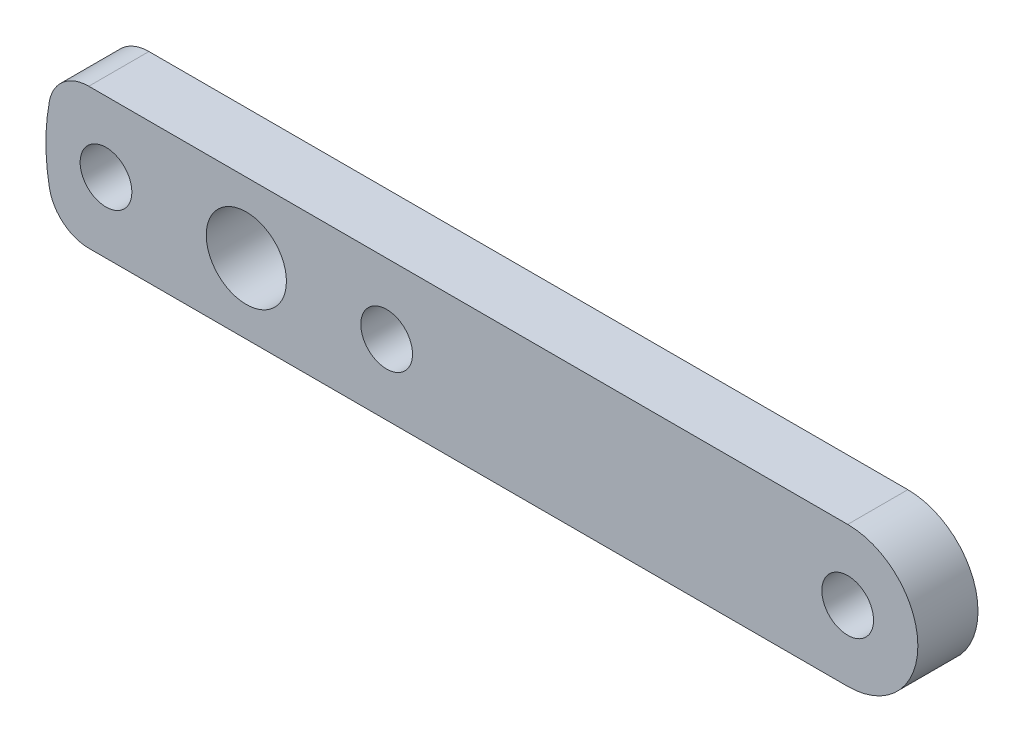
from build123d import *

# Parameters (mm, degrees)
SKETCH1_R           = 1.29
SKETCH1_R_2         = 2
BOSS_EXTRUDE1_DEPTH = 1.5
FILLET1_R           = 2


with BuildPart() as part:
    # Sketch1 → Boss-Extrude1 (new, symmetric)
    with BuildSketch(Plane.XY):
        with BuildLine():
            Line((-9.367496998, 3.5), (30, 3.5))
            ThreePointArc((30, 3.5), (33.5, 0), (30, -3.5))
            Line((30, -3.5), (-9.367496998, -3.5))
            ThreePointArc((-9.367496998, -3.5), (-10, 0), (-9.367496998, 3.5))
        make_face()
        with Locations((-7, 0)):
            Circle(SKETCH1_R, mode=Mode.SUBTRACT)
        with Locations((7, 0)):
            Circle(SKETCH1_R, mode=Mode.SUBTRACT)
        with Locations((30, 0)):
            Circle(SKETCH1_R, mode=Mode.SUBTRACT)
        Circle(SKETCH1_R_2, mode=Mode.SUBTRACT)
    extrude(amount=BOSS_EXTRUDE1_DEPTH, both=True)

    # Fillet1
    fillet1_edges = [part.edges().sort_by_distance(p)[0] for p in [
        (-9.367496998, 3.5, 0),
        (-9.367496998, -3.5, 0),
    ]]
    fillet(fillet1_edges, radius=FILLET1_R)


solid = part.part
